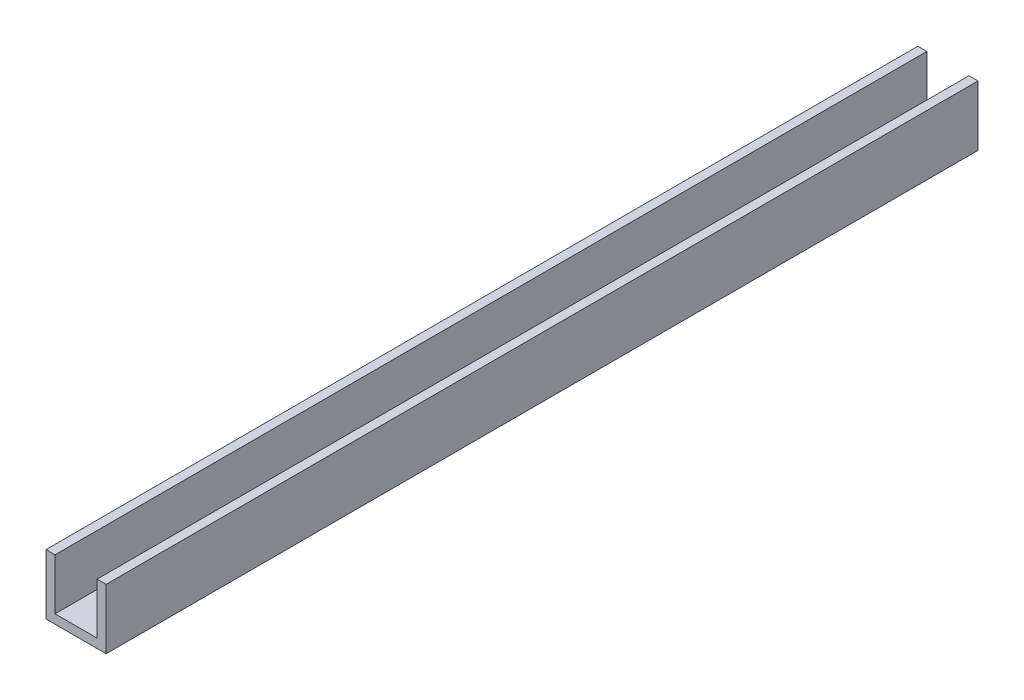
from build123d import *

# Parameters (mm, degrees)
EXTRUDE_1_DEPTH = 144.94


with BuildPart() as part:
    # Эскиз1 → Бобышка-Вытянуть1 (new body)
    with BuildSketch(Plane.XY):
        Polygon((0, 0), (10, 0), (10, 10), (8.5, 10), (8.5, 1.5), (1.5, 1.5), (1.5, 10), (0, 10), align=None)
    extrude(amount=EXTRUDE_1_DEPTH)


solid = part.part
